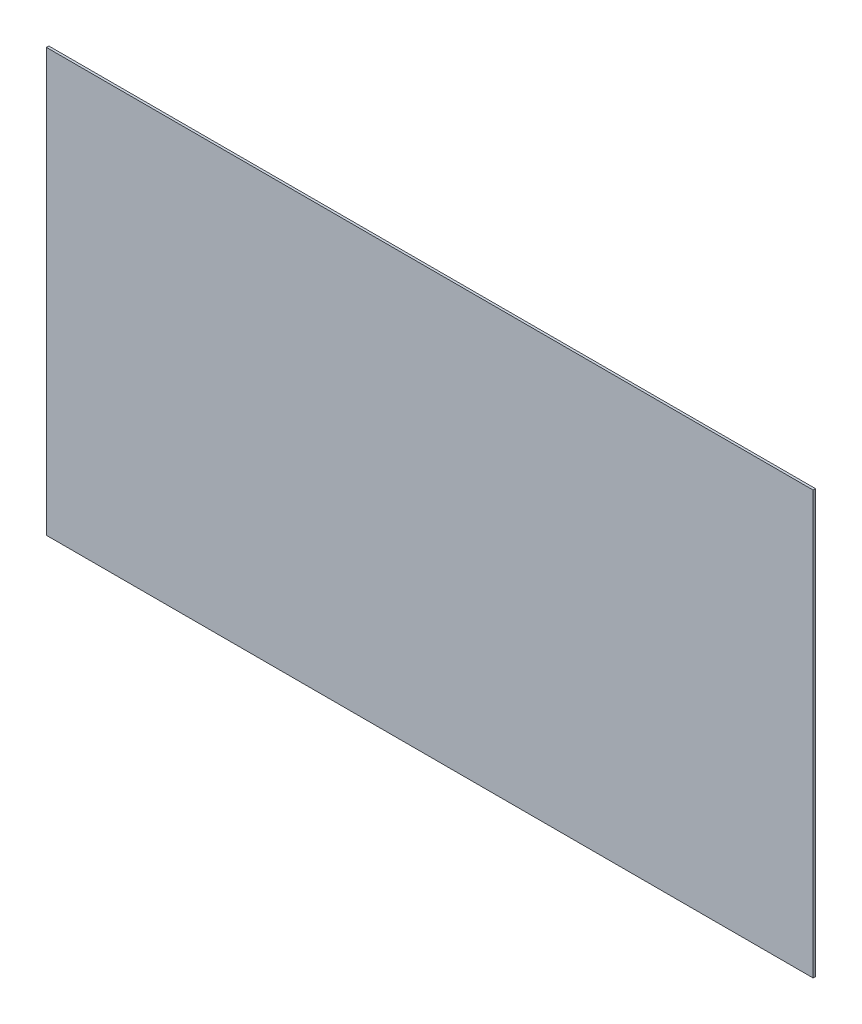
from build123d import *

# Parameters (mm, degrees)
SKETCH_1_W      = 635
SKETCH_1_H      = 350
EXTRUDE_1_DEPTH = 2


with BuildPart() as part:
    # 草图1 → 凸台-拉伸1 (new body)
    with BuildSketch(Plane.XY):
        with Locations((317.5, 175)):
            Rectangle(SKETCH_1_W, SKETCH_1_H)
    extrude(amount=EXTRUDE_1_DEPTH)


solid = part.part
